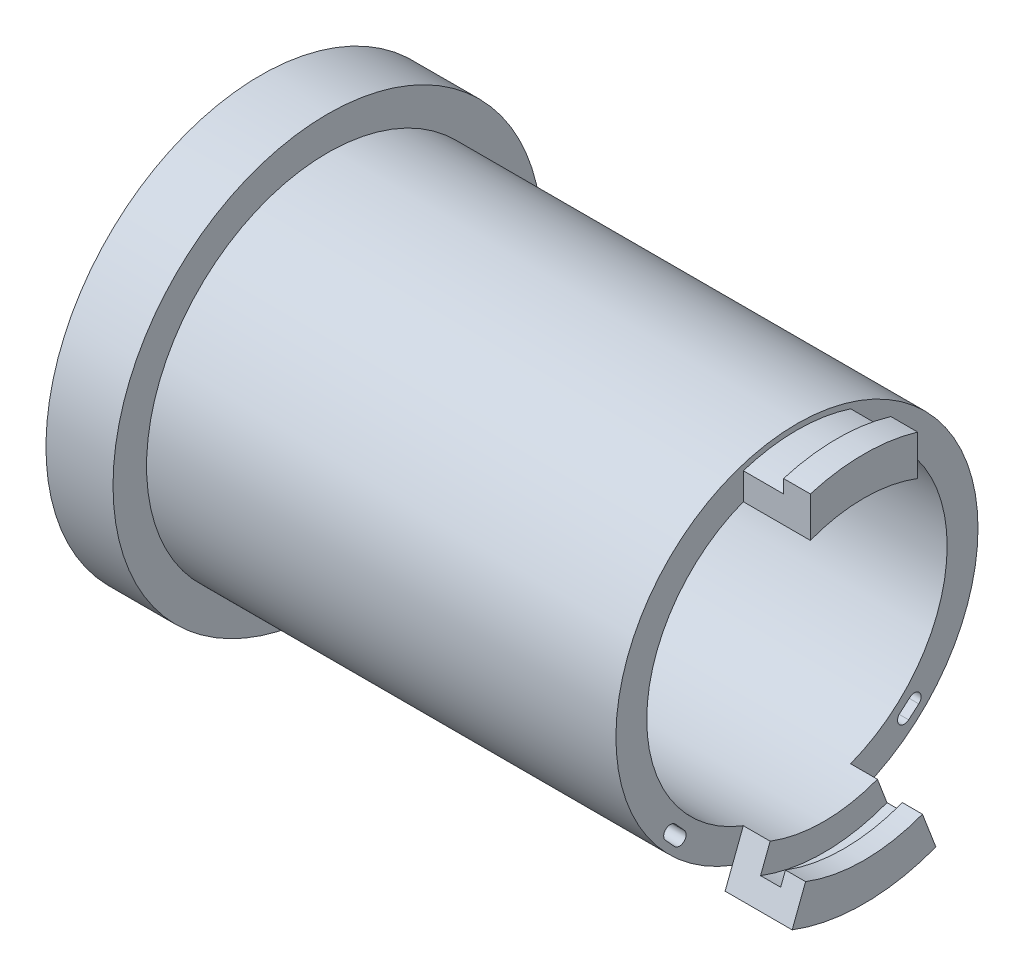
from build123d import *

# Parameters (mm, degrees)
SKETCH1_R               = 16
BOSS_EXTRUDE1_DEPTH     = 40
SKETCH2_R               = 11.2
CUT_EXTRUDE1_DEPTH      = 46.956501172
SKETCH3_OUTSIDE_W       = 46.08
SKETCH3_OUTSIDE_H       = 46.08
SKETCH3_OUTSIDE_R       = 13.5
CUT_EXTRUDE2_DEPTH      = 35
CUT_EXTRUDE3_START      = -3
CUT_EXTRUDE3_DEPTH      = 3
CUT_EXTRUDE9_DEPTH      = 46.956501172
CUT_EXTRUDE9_DEPTH_BACK = 3
BOSS_EXTRUDE3_START     = -1.5
BOSS_EXTRUDE3_DEPTH     = 1.5
BOSS_EXTRUDE4_START     = 5
BOSS_EXTRUDE4_DEPTH     = 5
CUT_EXTRUDE10_START     = 3
CUT_EXTRUDE10_DEPTH     = 3
CUT_EXTRUDE11_DEPTH     = 3
BOSS_EXTRUDE5_DEPTH     = 1.5
CUT_EXTRUDE12_DEPTH     = 46.956501172
CUT_EXTRUDE13_DEPTH     = 1


with BuildPart() as part:
    # Sketch1 → Boss-Extrude1 (new body)
    with BuildSketch(Plane(origin=(0, 0, 0), x_dir=(0, 0, -1), z_dir=(1, 0, 0))):
        Circle(SKETCH1_R)
    extrude(amount=BOSS_EXTRUDE1_DEPTH)

    # Sketch2 → Cut-Extrude1 (cut, through all)
    with BuildSketch(Plane(origin=(40, 0, 0), x_dir=(0, 0, -1), z_dir=(1, 0, 0))):
        Circle(SKETCH2_R)
    extrude(amount=-CUT_EXTRUDE1_DEPTH, mode=Mode.SUBTRACT)

    # Sketch3 outside → Cut-Extrude2 (cut)
    with BuildSketch(Plane(origin=(40, 0, 0), x_dir=(0, 0, -1), z_dir=(1, 0, 0))):
        Rectangle(SKETCH3_OUTSIDE_W, SKETCH3_OUTSIDE_H)
        Circle(SKETCH3_OUTSIDE_R, mode=Mode.SUBTRACT)
    extrude(amount=-CUT_EXTRUDE2_DEPTH, mode=Mode.SUBTRACT)

    # Sketch4 → Cut-Extrude3 (cut)
    with BuildSketch(Plane.ZY.offset(CUT_EXTRUDE3_START)):
        with BuildLine():
            Line((-4, 10.461357464), (-4, 13.461357464))
            ThreePointArc((-4, 13.461357464), (0, 14.043081741), (4, 13.461357464))
            Line((4, 13.461357464), (4, 10.461357464))
            ThreePointArc((4, 10.461357464), (0, 11.2), (-4, 10.461357464))
        make_face()
    extrude(amount=CUT_EXTRUDE3_DEPTH, mode=Mode.SUBTRACT)

    # Sketch11 → Cut-Extrude9 (cut, two sides: drawn at the far end of the back side and taken through both)
    with BuildSketch(Plane.ZY.offset(-CUT_EXTRUDE9_DEPTH_BACK)):
        with BuildLine():
            Line((31.521155816, -96.172447268), (4.983269846, -15.204177769))
            Line((4.983269846, -15.204177769), (4, -12.204177769))
            ThreePointArc((4, -12.204177769), (0, -12.842972982), (-4, -12.204177769))
            Line((-4, -12.204177769), (-4.983269846, -15.204177769))
            Line((-4.983269846, -15.204177769), (-31.521155816, -96.172447268))
            Line((-31.521155816, -96.172447268), (-31.521155816, -266.585123526))
            Line((-31.521155816, -266.585123526), (31.521155816, -266.585123526))
            Line((31.521155816, -266.585123526), (31.521155816, -96.172447268))
        make_face()
    extrude(amount=CUT_EXTRUDE9_DEPTH + CUT_EXTRUDE9_DEPTH_BACK, mode=Mode.SUBTRACT)

    # Sketch15 → Boss-Extrude3 (add)
    with BuildSketch(Plane.ZY.offset(BOSS_EXTRUDE3_START)):
        with BuildLine():
            Line((-4, -12.204177769), (-4.327756615, -13.204177769))
            ThreePointArc((-4.327756615, -13.204177769), (0, -13.895315322), (4.327756615, -13.204177769))
            Line((4.327756615, -13.204177769), (4, -12.204177769))
            ThreePointArc((4, -12.204177769), (0, -12.842972982), (-4, -12.204177769))
        make_face()
        with BuildLine():
            Line((-4, 12.461357464), (-4, 13.461357464))
            ThreePointArc((-4, 13.461357464), (0, 14.043081741), (4, 13.461357464))
            Line((4, 13.461357464), (4, 12.461357464))
            ThreePointArc((4, 12.461357464), (0, 13.087605964), (-4, 12.461357464))
        make_face()
    extrude(amount=BOSS_EXTRUDE3_DEPTH)

    # Sketch16 → Boss-Extrude4 (add)
    with BuildSketch(Plane(origin=(40, 0, 0), x_dir=(0, 0, -1), z_dir=(1, 0, 0)).offset(BOSS_EXTRUDE4_START)):
        with BuildLine():
            Line((-4, 10.461357464), (-4, 13.461357464))
            ThreePointArc((-4, 13.461357464), (0, 14.043081741), (4, 13.461357464))
            Line((4, 13.461357464), (4, 10.461357464))
            ThreePointArc((4, 10.461357464), (0, 11.2), (-4, 10.461357464))
        make_face()
        with BuildLine():
            Line((-4, -10.461357464), (-5.357142857, -14.010746604))
            ThreePointArc((-5.357142857, -14.010746604), (0, -15), (5.357142857, -14.010746604))
            Line((5.357142857, -14.010746604), (4, -10.461357464))
            ThreePointArc((4, -10.461357464), (0, -11.2), (-4, -10.461357464))
        make_face()
    extrude(amount=-BOSS_EXTRUDE4_DEPTH)

    # Sketch17 → Cut-Extrude10 (cut)
    with BuildSketch(Plane(origin=(40, 0, 0), x_dir=(0, 0, -1), z_dir=(1, 0, 0)).offset(CUT_EXTRUDE10_START)):
        with BuildLine():
            Line((-4, 13.461357464), (-4, 12.461357464))
            ThreePointArc((-4, 12.461357464), (0, 13.087605964), (4, 12.461357464))
            Line((4, 12.461357464), (4, 13.461357464))
            ThreePointArc((4, 13.461357464), (0, 14.043081741), (-4, 13.461357464))
        make_face()
    extrude(amount=-CUT_EXTRUDE10_DEPTH, mode=Mode.SUBTRACT)

    # Sketch18 → Cut-Extrude11 (cut)
    with BuildSketch(Plane(origin=(45, 0, 0), x_dir=(0, 0, -1), z_dir=(1, 0, 0))):
        with BuildLine():
            Line((-4, -10.461357464), (-4.714285714, -12.329457012))
            ThreePointArc((-4.714285714, -12.329457012), (0, -13.2), (4.714285714, -12.329457012))
            Line((4.714285714, -12.329457012), (4, -10.461357464))
            ThreePointArc((4, -10.461357464), (0, -11.2), (-4, -10.461357464))
        make_face()
    extrude(amount=-CUT_EXTRUDE11_DEPTH, mode=Mode.SUBTRACT)

    # Sketch21 → Boss-Extrude5 (add)
    with BuildSketch(Plane(origin=(45, 0, 0), x_dir=(0, 0, -1), z_dir=(1, 0, 0))):
        with BuildLine():
            Line((-4.714285714, -12.329457012), (-4.357142857, -11.395407238))
            ThreePointArc((-4.357142857, -11.395407238), (0, -12.2), (4.357142857, -11.395407238))
            Line((4.357142857, -11.395407238), (4.714285714, -12.329457012))
            ThreePointArc((4.714285714, -12.329457012), (0, -13.2), (-4.714285714, -12.329457012))
        make_face()
    extrude(amount=-BOSS_EXTRUDE5_DEPTH)

    # Sketch22 → Cut-Extrude12 (cut, through all)
    with BuildSketch(Plane(origin=(40, 0, 0), x_dir=(0, 0, -1), z_dir=(1, 0, 0))):
        with BuildLine():
            Line((7.673498409, -9.029962065), (8.430853573, -8.376958883))
            ThreePointArc((8.430853573, -8.376958883), (9.136032746, -8.429134874), (9.083856755, -9.134314047))
            Line((9.083856755, -9.134314047), (8.326501591, -9.787317229))
            ThreePointArc((8.326501591, -9.787317229), (7.621322418, -9.735141237), (7.673498409, -9.029962065))
        make_face()
        with BuildLine():
            Line((-9.134721879, -9.238785274), (-9.806253772, -8.497809622))
            ThreePointArc((-9.806253772, -8.497809622), (-9.771531893, -7.79155585), (-9.065278121, -7.826277729))
            Line((-9.065278121, -7.826277729), (-8.393746228, -8.567253381))
            ThreePointArc((-8.393746228, -8.567253381), (-8.428468107, -9.273507153), (-9.134721879, -9.238785274))
        make_face()
    extrude(amount=-CUT_EXTRUDE12_DEPTH, mode=Mode.SUBTRACT)

    # Sketch23 → Cut-Extrude13 (cut)
    with BuildSketch(Plane.ZY):
        with BuildLine():
            Line((9.771531893, -7.79155585), (10.985476817, -8.672656141))
            ThreePointArc((10.985476817, -8.672656141), (0.600129097, -13.983401249), (-10.202038674, -9.581965994))
            Line((-10.202038674, -9.581965994), (-9.136032746, -8.429134874))
            Line((-9.136032746, -8.429134874), (-7.502618183, -9.357538492))
            ThreePointArc((-7.502618183, -9.357538492), (0.59553752, -11.979070969), (8.393746228, -8.567253381))
            Line((8.393746228, -8.567253381), (9.771531893, -7.79155585))
        make_face()
    extrude(amount=-CUT_EXTRUDE13_DEPTH, mode=Mode.SUBTRACT)


solid = part.part
